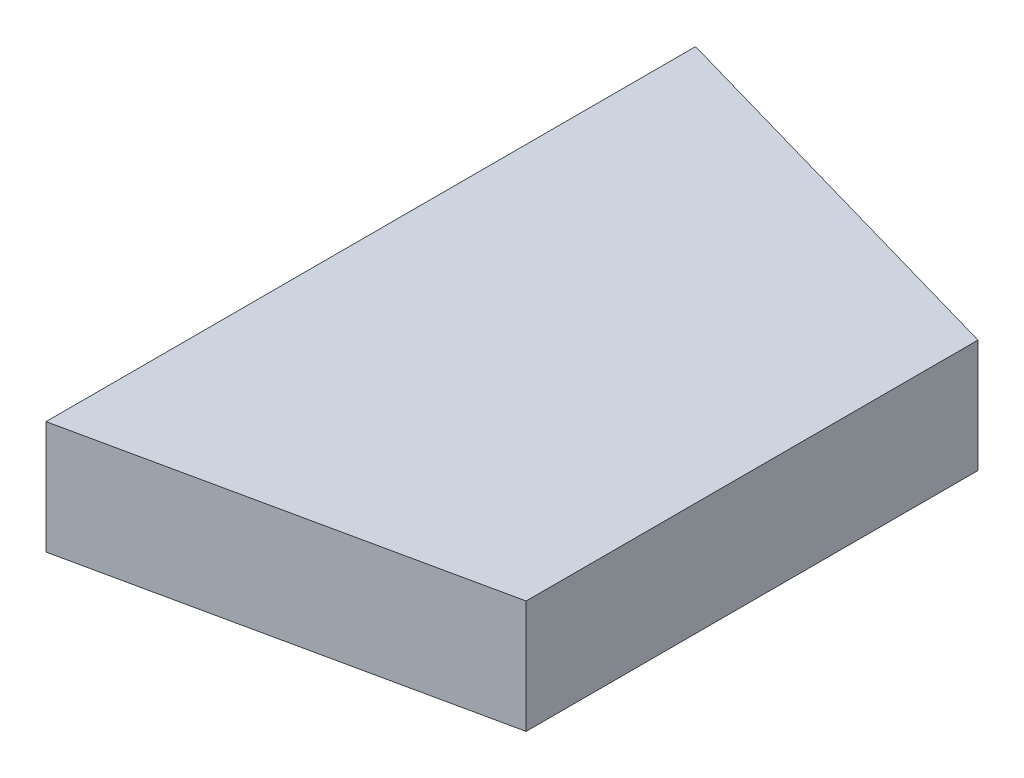
from build123d import *

# Parameters (mm, degrees)
EXTRUDE_START       = -4
EXTRUDE_1_DEPTH     = 8
SKETCH_2_R          = 3
CUT_EXTRUDE_1_DEPTH = 124.239604024


with BuildPart() as part:
    # 草图1 → 凸台-拉伸1 (new body)
    with BuildSketch(Plane(origin=(0, 0, 0), x_dir=(1, 0, 0), z_dir=(0, 1, 0)).offset(EXTRUDE_START)):
        Polygon((76, -66), (76, -20), (104, -28), (104, -60), align=None)
    extrude(amount=EXTRUDE_1_DEPTH)

    # 草图2 → 切除-拉伸1 (cut, through all)
    with BuildSketch(Plane(origin=(0, 0, 0), x_dir=(1, 0, 0), z_dir=(0, 1, 0))):
        with Locations(Location((80, -62, 0), (0, 0, 270))):
            Circle(SKETCH_2_R)
        with Locations((80, -24)):
            Circle(SKETCH_2_R)
        with Locations(Location((100, -50, 0), (0, 0, 270))):
            Circle(SKETCH_2_R)
    extrude(amount=-CUT_EXTRUDE_1_DEPTH, mode=Mode.SUBTRACT)


solid = part.part
